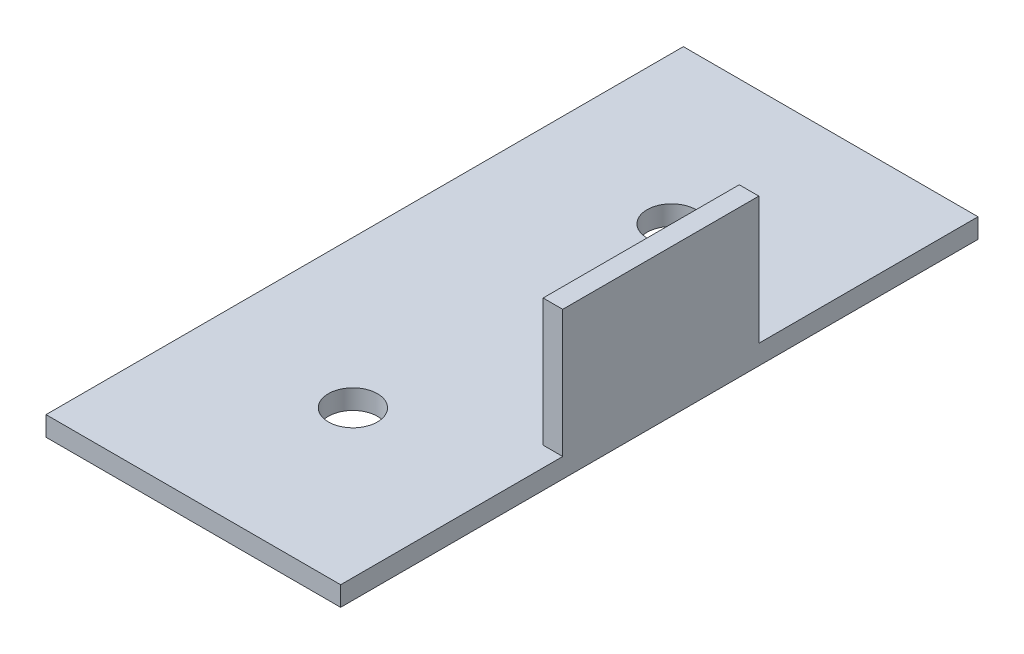
from build123d import *

# Parameters (mm, degrees)
EXTRUDE_1_DEPTH     = 20
SKETCH_4_W          = 20
SKETCH_4_H          = 16.999999963
CUT_EXTRUDE_1_DEPTH = 47.935226042
SKETCH_6_W          = 30.048551437
SKETCH_6_H          = 22.650000031
EXTRUDE_1_2_DEPTH   = 2
SKETCH_7_R          = 2.5
CUT_EXTRUDE_2_DEPTH = 53.675836409


with BuildPart() as part:
    # Эскиз1 → Extrude 1 (new body)
    with BuildSketch(Plane.XY):
        Polygon((0, 30), (0, 0), (-28.048551439, 0), (-28.048551439, -2), (2, -2), (2, 30), align=None)
    extrude(amount=EXTRUDE_1_DEPTH)

    # Эскиз4 → Вырез-Вытянуть1 (cut, through all)
    with BuildSketch(Plane(origin=(2, 0, 0), x_dir=(0, 0, -1), z_dir=(1, 0, 0))):
        with Locations((-10, 21.500000019)):
            Rectangle(SKETCH_4_W, SKETCH_4_H)
    extrude(amount=-CUT_EXTRUDE_1_DEPTH, mode=Mode.SUBTRACT)

    # Эскиз6 → Extrude 1 2 (add)
    with BuildSketch(Plane(origin=(0, 0, 0), x_dir=(1, 0, 0), z_dir=(0, 1, 0))):
        Polygon((-28.048551439, 0), (1.999999998, 0), (2.000000002, 22.349999969), (-28.048551439, 22.349999969), align=None)
        with Locations((-13.024275721, -31.325000016)):
            Rectangle(SKETCH_6_W, SKETCH_6_H)
    extrude(amount=-EXTRUDE_1_2_DEPTH)

    # Эскиз7 → Вырез-Вытянуть2 (cut, through all)
    with BuildSketch(Plane(origin=(0, 0, 0), x_dir=(1, 0, 0), z_dir=(0, 1, 0))):
        with Locations(Location((-12.999999999, 6.09999997, 0), (0, 0, 270))):
            Circle(SKETCH_7_R)
        with Locations(Location((-13.000000001, -26.40000003, 0), (0, 0, 270))):
            Circle(SKETCH_7_R)
    extrude(amount=-CUT_EXTRUDE_2_DEPTH, mode=Mode.SUBTRACT)


solid = part.part
